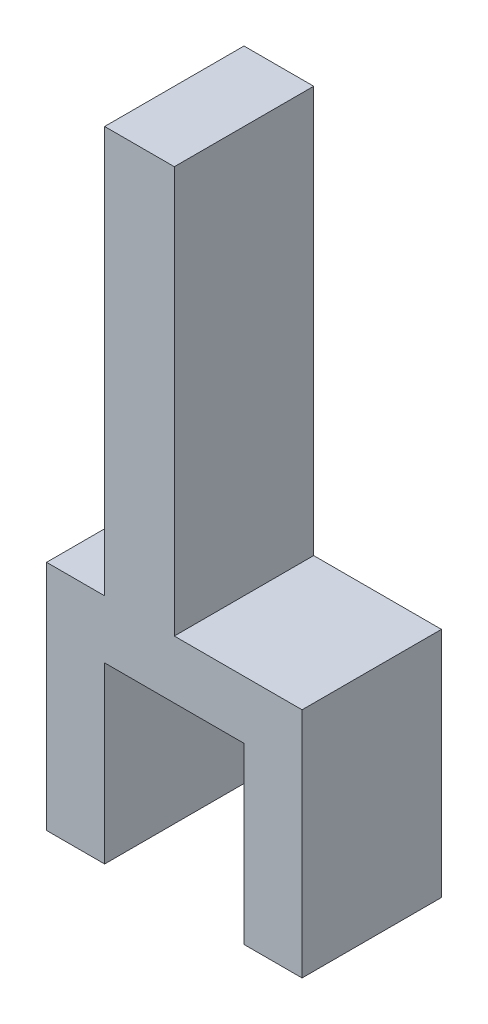
from build123d import *

# Parameters (mm, degrees)
EXTRUDE_1_DEPTH = 12


with BuildPart() as part:
    # Эскиз1 → Бобышка-Вытянуть1 (new body)
    with BuildSketch(Plane.XY):
        Polygon((0, 0), (5, 0), (5, 15), (17, 15), (17, 0), (22, 0), (22, 20), (11, 20), (11, 55), (5, 55), (5, 20), (0, 20), align=None)
    extrude(amount=EXTRUDE_1_DEPTH)


solid = part.part
